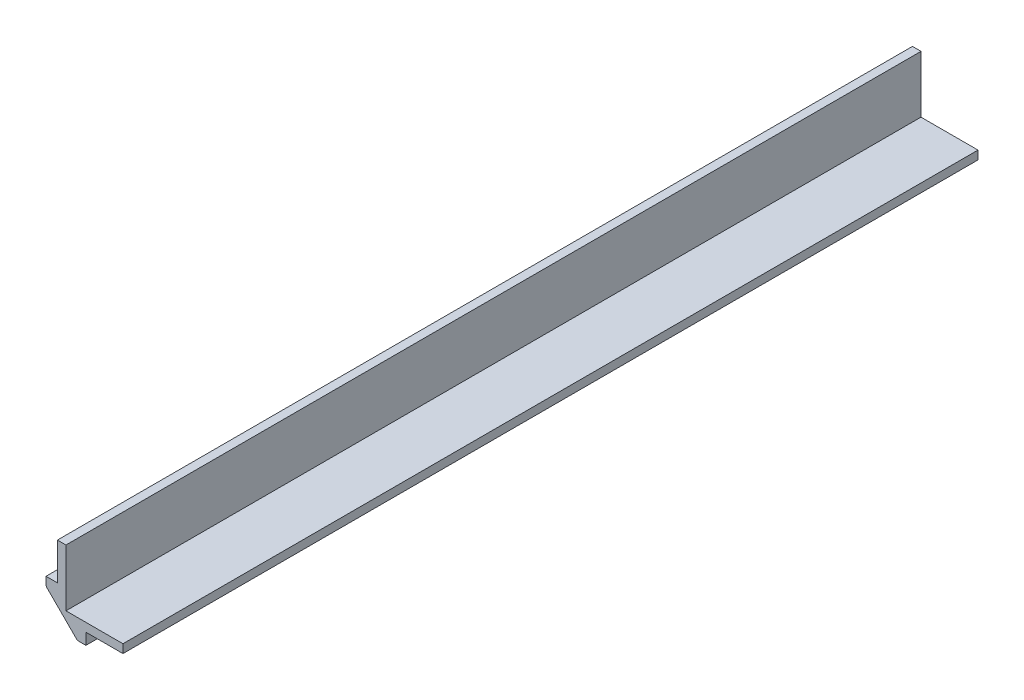
from build123d import *

# Parameters (mm, degrees)
BOSS_EXTRUDE1_DEPTH = 300
FILLET1_R           = 1.5


with BuildPart() as part:
    # Sketch1 → Boss-Extrude1 (new body)
    with BuildSketch(Plane.XY.offset(280)):
        Polygon((-7, 4), (4, -7), (7, -7), (7, -3), (20, -3), (20, 0), (0, 0), (0, 20), (-3, 20), (-3, 7), (-7, 7), align=None)
    extrude(amount=-BOSS_EXTRUDE1_DEPTH)

    # Fillet1
    fillet1_edges = [part.edges().sort_by_distance(p)[0] for p in [
        (4, -7, 130),
        (-7, 4, 130),
    ]]
    fillet(fillet1_edges, radius=FILLET1_R)


solid = part.part
